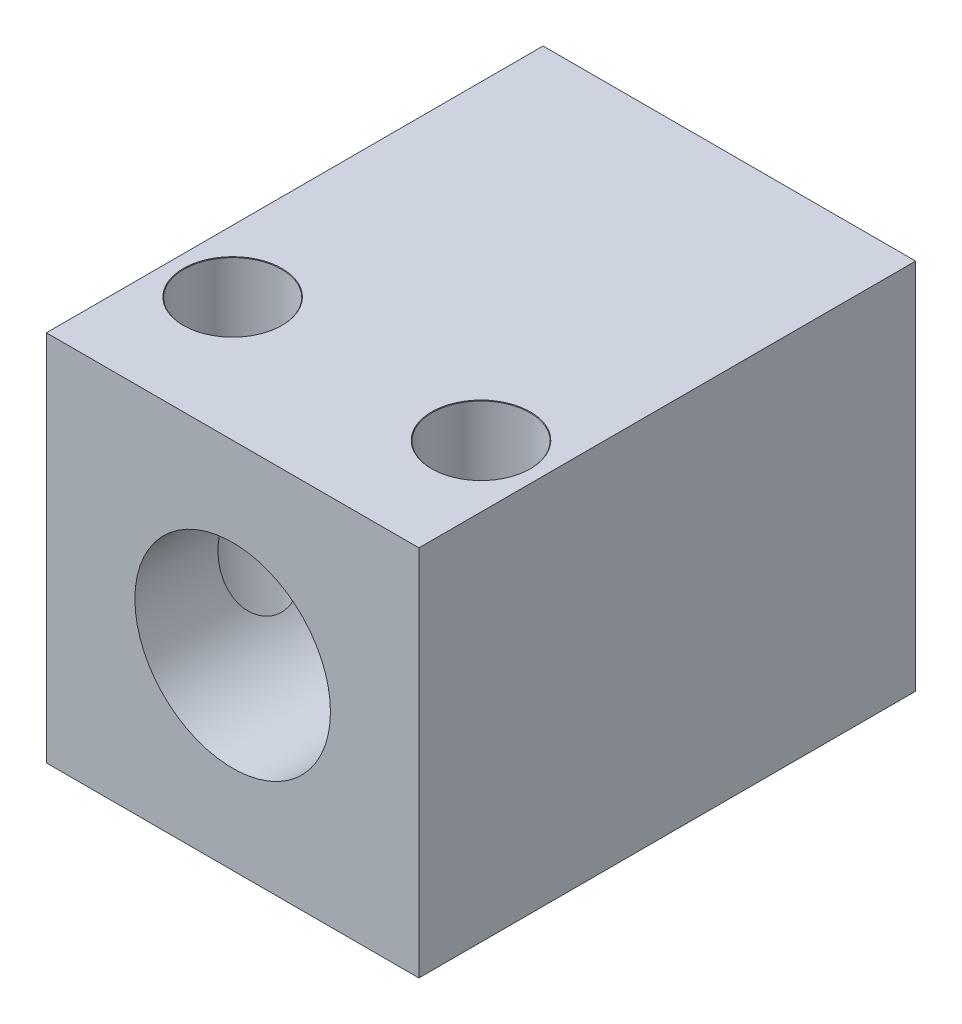
from build123d import *

# Parameters (mm, degrees)
BOSS_EXTRUDE1_START             = -711.2
SKETCH5_W                       = 19.05
SKETCH5_H                       = 19.05
SKETCH5_R                       = 5
BOSS_EXTRUDE1_DEPTH             = 25.4
F_5_0MM_DOWEL_HOLE2_D           = 5
F_5_0MM_DOWEL_HOLE2_DEPTH       = 25.4
F_5_0MM_DOWEL_HOLE2_CSINK_D     = 5.05
F_5_0MM_DOWEL_HOLE2_CSINK_ANGLE = 90
F_5_0MM_DOWEL_HOLE2_TIP         = 1.502151548
F_3_0MM_DOWEL_HOLE2_D           = 3
F_3_0MM_DOWEL_HOLE2_DEPTH       = 12.7
F_3_0MM_DOWEL_HOLE2_CSINK_D     = 3.05
F_3_0MM_DOWEL_HOLE2_CSINK_ANGLE = 90
F_3_0MM_DOWEL_HOLE2_TIP         = 0.901290929


with BuildPart() as part:
    # Sketch5 → Boss-Extrude1 (new body)
    with BuildSketch(Plane.XY.offset(BOSS_EXTRUDE1_START)):
        with Locations((63.5, 83.82)):
            Rectangle(SKETCH5_W, SKETCH5_H)
        with Locations((63.5, 83.82)):
            Circle(SKETCH5_R, mode=Mode.SUBTRACT)
    extrude(amount=BOSS_EXTRUDE1_DEPTH)

    # Ø5.0mm Dowel Hole2
    with Locations(Plane(origin=(0, 93.345, 0), x_dir=(1, 0, 0), z_dir=(0, 1, 0))):
        with Locations((57.15, 692.15), (69.85, 692.15)):
            CounterSinkHole(F_5_0MM_DOWEL_HOLE2_D / 2, F_5_0MM_DOWEL_HOLE2_CSINK_D / 2, depth=F_5_0MM_DOWEL_HOLE2_DEPTH, counter_sink_angle=F_5_0MM_DOWEL_HOLE2_CSINK_ANGLE)
            with Locations((0, 0, -(F_5_0MM_DOWEL_HOLE2_DEPTH + F_5_0MM_DOWEL_HOLE2_TIP / 2))):  # 118° drill point
                Cone(0, F_5_0MM_DOWEL_HOLE2_D / 2, F_5_0MM_DOWEL_HOLE2_TIP, mode=Mode.SUBTRACT)

    # Ø3.0mm Dowel Hole2
    with Locations(Plane(origin=(0, 0, -711.2), x_dir=(-1, 0, 0), z_dir=(0, 0, -1))):
        with Locations((-58.42, 78.74), (-68.58, 78.74), (-58.42, 88.9), (-68.58, 88.9)):
            CounterSinkHole(F_3_0MM_DOWEL_HOLE2_D / 2, F_3_0MM_DOWEL_HOLE2_CSINK_D / 2, depth=F_3_0MM_DOWEL_HOLE2_DEPTH, counter_sink_angle=F_3_0MM_DOWEL_HOLE2_CSINK_ANGLE)
            with Locations((0, 0, -(F_3_0MM_DOWEL_HOLE2_DEPTH + F_3_0MM_DOWEL_HOLE2_TIP / 2))):  # 118° drill point
                Cone(0, F_3_0MM_DOWEL_HOLE2_D / 2, F_3_0MM_DOWEL_HOLE2_TIP, mode=Mode.SUBTRACT)


solid = part.part
